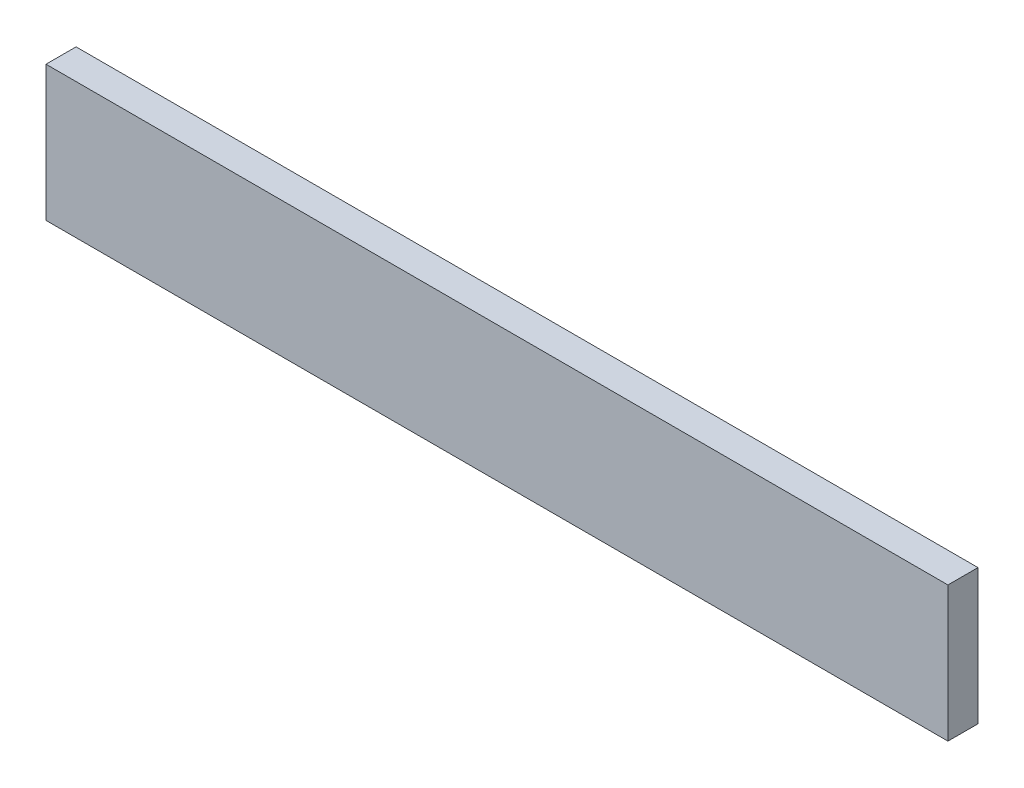
from build123d import *

# Parameters (mm, degrees)
SKETCH3_W           = 152.4
SKETCH3_H           = 22.86
BOSS_EXTRUDE4_DEPTH = 5.08


with BuildPart() as part:
    # Sketch3 → Boss-Extrude4 (new body)
    with BuildSketch(Plane.XY):
        with Locations((-515.249402451, 4415.509658897)):
            Rectangle(SKETCH3_W, SKETCH3_H)
    extrude(amount=BOSS_EXTRUDE4_DEPTH)


solid = part.part
